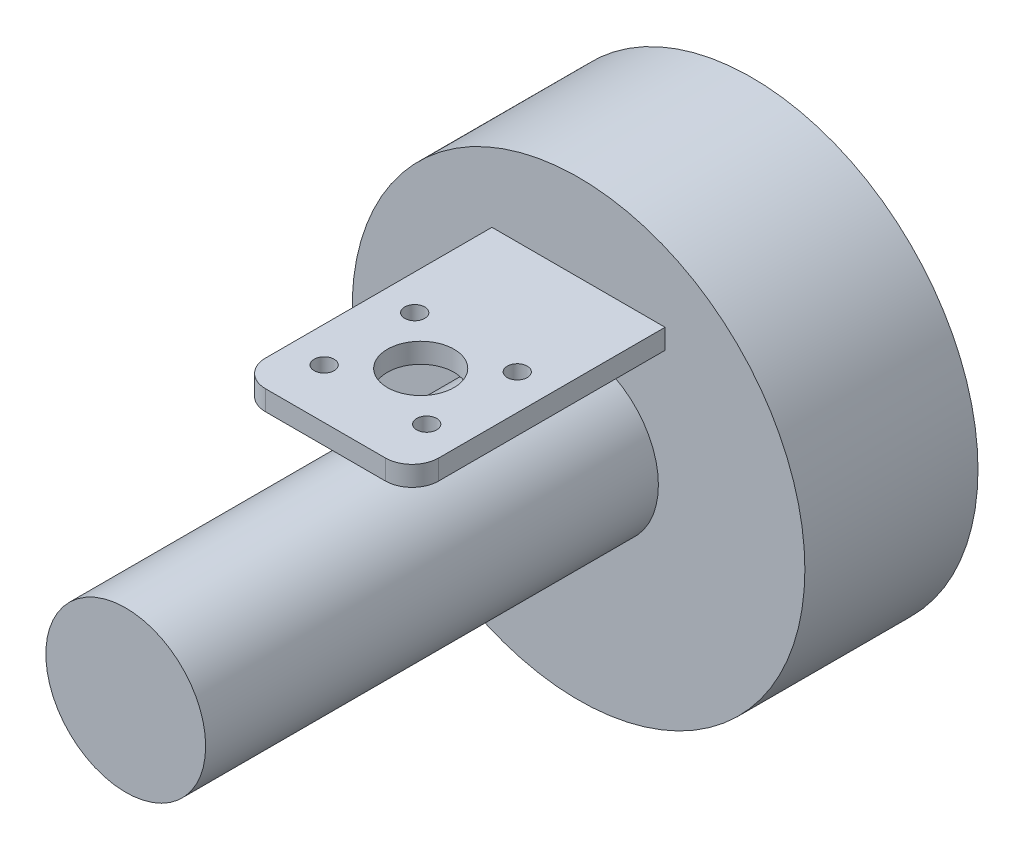
from build123d import *

# Parameters (mm, degrees)
SKETCH_1_W          = 68
SKETCH_1_H          = 12
EXTRUDE_1_DEPTH     = 38
SKETCH_3_R          = 1.5
SKETCH_3_R_2        = 5
CUT_EXTRUDE_1_DEPTH = 3
FILLET_1_R          = 4


with BuildPart() as part:
    # Эскиз1 → Повернуть1 (revolve)
    with BuildSketch(Plane(origin=(0, 0, 0), x_dir=(0, 0, -1), z_dir=(1, 0, 0)), mode=Mode.PRIVATE) as revolve_1_sk:
        with Locations((34, 6)):
            Rectangle(SKETCH_1_W, SKETCH_1_H)
        Polygon((68, 12), (68, 0), (94, 0), (94, 34), (68, 34), align=None)
    revolve(revolve_1_sk.sketch.rotate(Axis((0, 0, 0), (0, 0, -1)), 90), axis=Axis((0, 0, 0), (0, 0, -1)))

    # Эскиз2 → Бобышка-Вытянуть1 (add)
    with BuildSketch(Plane.XY.offset(-68)):
        Polygon((0, 21), (13, 21), (13, 18), (-13, 18), (-13, 21), align=None)
    extrude(amount=EXTRUDE_1_DEPTH)

    # Эскиз3 → Вырез-Вытянуть1 (cut)
    with BuildSketch(Plane(origin=(0, 21, 0), x_dir=(1, 0, 0), z_dir=(0, 1, 0))):
        with Locations(Location((-7.7, 51.1, 0), (0, 0, 270))):
            Circle(SKETCH_3_R)
        with Locations(Location((7.7, 51.1, 0), (0, 0, 270))):
            Circle(SKETCH_3_R)
        with Locations(Location((7.7, 37.5, 0), (0, 0, 270))):
            Circle(SKETCH_3_R)
        with Locations(Location((-7.7, 37.5, 0), (0, 0, 270))):
            Circle(SKETCH_3_R)
        with Locations(Location((0, 44.3, 0), (0, 0, 270))):
            Circle(SKETCH_3_R_2)
    extrude(amount=-CUT_EXTRUDE_1_DEPTH, mode=Mode.SUBTRACT)

    # Скругление1
    fillet_1_edges = [part.edges().sort_by_distance(p)[0] for p in [
        (-13, 19.5, -30),
        (13, 19.5, -30),
    ]]
    fillet(fillet_1_edges, radius=FILLET_1_R)


solid = part.part
